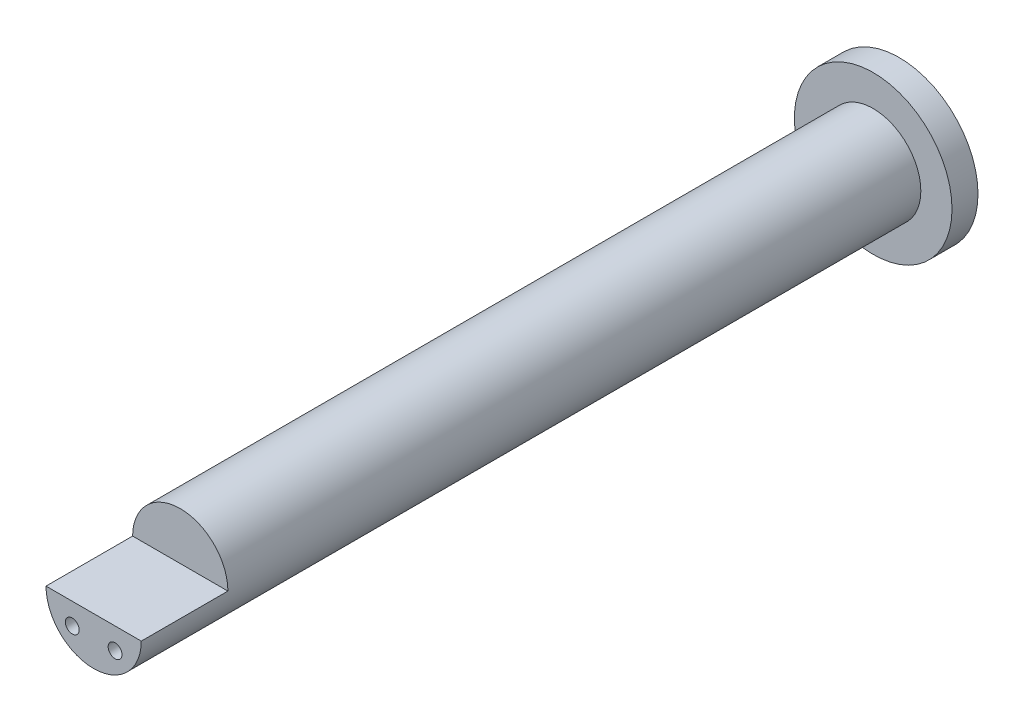
from build123d import *

# Parameters (mm, degrees)
ESBO_O1_R                 = 9.1
RESSALTO_EXTRUS_O1_DEPTH  = 3
ESBO_O2_R                 = 5.5
RESSALTO_EXTRUS_O2_DEPTH  = 80
RESSALTO_EXTRUS_O3_DEPTH  = 10
FURO_ROSCADO_DE_M21_D     = 1.6
FURO_ROSCADO_DE_M21_DEPTH = 10
FURO_ROSCADO_DE_M21_TIP   = 0.480688495


with BuildPart() as part:
    # Esboço1 → Ressalto-extrusão1 (new body)
    with BuildSketch(Plane.XY):
        Circle(ESBO_O1_R)
    extrude(amount=RESSALTO_EXTRUS_O1_DEPTH)

    # Esboço2 → Ressalto-extrusão2 (add)
    with BuildSketch(Plane.XY.offset(3)):
        Circle(ESBO_O2_R)
    extrude(amount=RESSALTO_EXTRUS_O2_DEPTH)

    # Esboço3 → Ressalto-extrusão3 (add)
    with BuildSketch(Plane.XY.offset(83)):
        with BuildLine():
            Line((-5.5, 0), (5.5, 0))
            ThreePointArc((5.5, 0), (0, -5.5), (-5.5, 0))
        make_face()
    extrude(amount=RESSALTO_EXTRUS_O3_DEPTH)

    # Furo roscado de M21
    with Locations(Plane.XY.offset(93)):
        with Locations((-2.474873734, -2.474873734), (2.474873734, -2.474873734)):
            Hole(FURO_ROSCADO_DE_M21_D / 2, depth=FURO_ROSCADO_DE_M21_DEPTH)
            with Locations((0, 0, -(FURO_ROSCADO_DE_M21_DEPTH + FURO_ROSCADO_DE_M21_TIP / 2))):  # 118° drill point
                Cone(0, FURO_ROSCADO_DE_M21_D / 2, FURO_ROSCADO_DE_M21_TIP, mode=Mode.SUBTRACT)


solid = part.part
